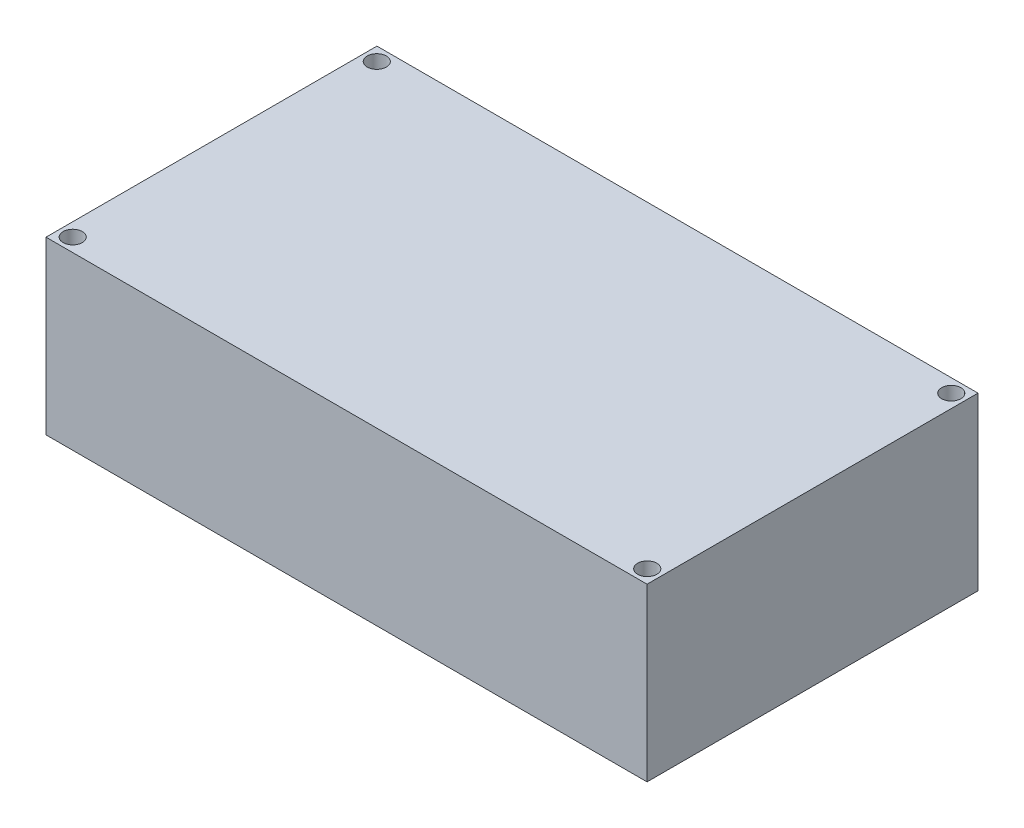
from build123d import *

# Parameters (mm, degrees)
SKETCH_1_W          = 187.8
SKETCH_1_H          = 103.4
EXTRUDE_1_DEPTH     = 53.5
SKETCH_2_R          = 3
CUT_EXTRUDE_1_DEPTH = 120.801293816


with BuildPart() as part:
    # Эскиз1 → Бобышка-Вытянуть1 (new body)
    with BuildSketch(Plane(origin=(0, 0, 0), x_dir=(1, 0, 0), z_dir=(0, 1, 0))):
        Rectangle(SKETCH_1_W, SKETCH_1_H)
    extrude(amount=EXTRUDE_1_DEPTH)

    # Эскиз2 → Вырез-Вытянуть1 (cut, through all)
    with BuildSketch(Plane(origin=(0, 53.5, 0), x_dir=(1, 0, 0), z_dir=(0, 1, 0))):
        with Locations(Location((-89.75, 47.5, 0), (0, 0, 270))):
            Circle(SKETCH_2_R)
        with Locations(Location((89.75, 47.5, 0), (0, 0, 90))):
            Circle(SKETCH_2_R)
        with Locations(Location((89.75, -47.5, 0), (0, 0, 270))):
            Circle(SKETCH_2_R)
        with Locations(Location((-89.75, -47.5, 0), (0, 0, 90))):
            Circle(SKETCH_2_R)
    extrude(amount=-CUT_EXTRUDE_1_DEPTH, mode=Mode.SUBTRACT)


solid = part.part
